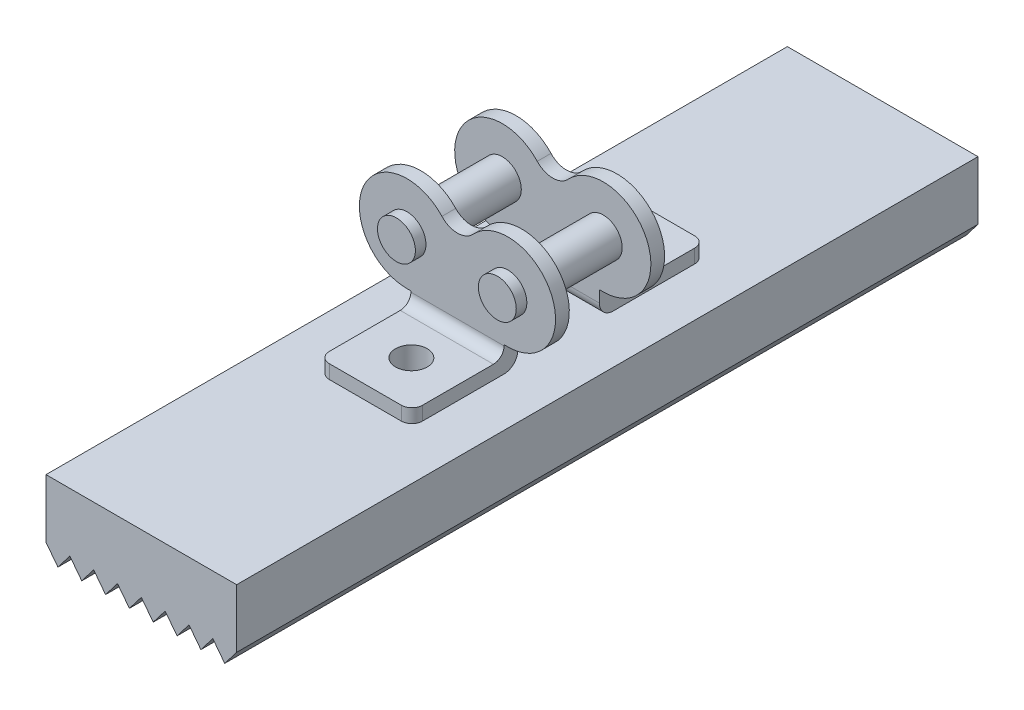
from build123d import *
from build123d.topology import SkipClean

# Parameters (mm, degrees)
BOSS_EXTRUDE1_DEPTH      = 1.3
BOSS_EXTRUDE2_DEPTH      = 10
BOSS_EXTRUDE2_DEPTH_BACK = 2.3
SKETCH2_R                = 1.79
SKETCH4_W                = 8.8
SKETCH4_H                = 1.3
BOSS_EXTRUDE4_DEPTH      = 2.4
SKETCH3_W                = 8.8
SKETCH3_H                = 10
BOSS_EXTRUDE3_DEPTH      = 1.3
FILLET4_R                = 1.3
FILLET6_R                = 1
SKETCH5_R                = 1.5
CUT_EXTRUDE1_DEPTH       = 2.4
FILLET7_R                = 1
FILLET4_OF_MIRROR1_R     = 1.3
FILLET6_OF_MIRROR1_R     = 1
FILLET7_OF_MIRROR1_R     = 1
BOSS_EXTRUDE5_START      = 7
SKETCH6_W                = 18
SKETCH6_H                = 70
SKETCH6_R                = 1.5
BOSS_EXTRUDE5_DEPTH      = 7
SKETCH9_R                = 4
CUT_EXTRUDE3_DEPTH       = 3
CUT_EXTRUDE4_DEPTH       = 72.965296541


with BuildPart() as part:
    # Sketch1 → Boss-Extrude1 (new body)
    with BuildSketch(Plane.XY):
        with BuildLine():
            Line((-4.7625, -4.5), (4.7625, -4.5))
            ThreePointArc((4.7625, -4.5), (8.887505516, 1.798424168), (1.465384615, 3.062520227))
            ThreePointArc((1.465384615, 3.062520227), (0, 2.423640328), (-1.465384615, 3.062520227))
            ThreePointArc((-1.465384615, 3.062520227), (-8.887505516, 1.798424168), (-4.7625, -4.5))
        make_face()
    boss_extrude1 = extrude(amount=BOSS_EXTRUDE1_DEPTH)

    # Sketch2 → Boss-Extrude2 (add, two sides: drawn at the far end of the back side and taken through both)
    with BuildSketch(Plane.XY.offset(1.3).offset(-BOSS_EXTRUDE2_DEPTH_BACK)):
        with Locations((-4.7625, 0)):
            Circle(SKETCH2_R)
        with Locations((4.7625, 0)):
            Circle(SKETCH2_R)
    extrude(amount=BOSS_EXTRUDE2_DEPTH + BOSS_EXTRUDE2_DEPTH_BACK)

    # Sketch4 → Boss-Extrude4 (add)
    with BuildSketch(Plane.XZ.offset(4.5)):
        with Locations((0, 0.65)):
            Rectangle(SKETCH4_W, SKETCH4_H)
    boss_extrude4 = extrude(amount=BOSS_EXTRUDE4_DEPTH)

    # Sketch3 → Boss-Extrude3 (add)
    with BuildSketch(Plane.XZ.offset(6.9)):
        with Locations((0, -3.7)):
            Rectangle(SKETCH3_W, SKETCH3_H)
    boss_extrude3 = extrude(amount=-BOSS_EXTRUDE3_DEPTH)

    # Fillet4
    fillet4_edges = [part.edges().sort_by_distance(p)[0] for p in [
        (0, -6.9, 1.3),
    ]]
    fillet(fillet4_edges, radius=FILLET4_R)

    # Fillet6
    fillet6_edges = [part.edges().sort_by_distance(p)[0] for p in [
        (0, -5.6, 0),
    ]]
    fillet(fillet6_edges, radius=FILLET6_R)

    # Sketch5 → Cut-Extrude1 (cut)
    with BuildSketch(Plane.XZ.offset(6.9)):
        with Locations(Location((0, -4.35, 0), (0, 0, 270))):
            Circle(SKETCH5_R)
    cut_extrude1 = extrude(amount=-CUT_EXTRUDE1_DEPTH, mode=Mode.SUBTRACT)

    # Fillet7
    fillet7_edges = [part.edges().sort_by_distance(p)[0] for p in [
        (-4.4, -6.25, -8.7),
        (4.4, -6.25, -8.7),
    ]]
    fillet(fillet7_edges, radius=FILLET7_R)

    # Mirror1: Boss-Extrude1, Boss-Extrude4, Boss-Extrude3, Cut-Extrude1 across plane
    add(boss_extrude1.mirror(Plane(origin=(0, 0, 5.15), x_dir=(1, 0, 0), z_dir=(0, 0, -1))))
    add(boss_extrude4.mirror(Plane(origin=(0, 0, 5.15), x_dir=(1, 0, 0), z_dir=(0, 0, -1))))
    add(boss_extrude3.mirror(Plane(origin=(0, 0, 5.15), x_dir=(1, 0, 0), z_dir=(0, 0, -1))))
    add(cut_extrude1.mirror(Plane(origin=(0, 0, 5.15), x_dir=(1, 0, 0), z_dir=(0, 0, -1))), mode=Mode.SUBTRACT)

    # Fillet4 of Mirror1
    fillet4_of_mirror1_edges = [part.edges().sort_by_distance(p)[0] for p in [
        (0, -6.9, 9),
    ]]
    fillet(fillet4_of_mirror1_edges, radius=FILLET4_OF_MIRROR1_R)

    # Fillet6 of Mirror1
    fillet6_of_mirror1_edges = [part.edges().sort_by_distance(p)[0] for p in [
        (0, -5.6, 10.3),
    ]]
    fillet(fillet6_of_mirror1_edges, radius=FILLET6_OF_MIRROR1_R)

    # Fillet7 of Mirror1
    fillet7_of_mirror1_edges = [part.edges().sort_by_distance(p)[0] for p in [
        (-4.4, -6.25, 19),
        (4.4, -6.25, 19),
    ]]
    fillet(fillet7_of_mirror1_edges, radius=FILLET7_OF_MIRROR1_R)

    # Sketch6 → Boss-Extrude5 (add)
    with SkipClean():  # the faces are left unmerged after this step: merging them gives an invalid solid
        with BuildSketch(Plane.XZ.offset(6.9).offset(BOSS_EXTRUDE5_START)):
            with Locations((0, 5.15)):
                Rectangle(SKETCH6_W, SKETCH6_H)
            with Locations(Location((0, 14.65, 0), (0, 0, 270))):
                Circle(SKETCH6_R, mode=Mode.SUBTRACT)
            with Locations(Location((0, -4.35, 0), (0, 0, 270))):
                Circle(SKETCH6_R, mode=Mode.SUBTRACT)
        extrude(amount=-BOSS_EXTRUDE5_DEPTH)

    # Sketch9 → Cut-Extrude3 (cut)
    with SkipClean():  # the faces are left unmerged after this step: merging them gives an invalid solid
        with BuildSketch(Plane.XZ.offset(13.9)):
            with Locations(Location((0, 14.65, 0), (0, 0, 270))):
                Circle(SKETCH9_R)
            with Locations(Location((0, -4.35, 0), (0, 0, 270))):
                Circle(SKETCH9_R)
        extrude(amount=-CUT_EXTRUDE3_DEPTH, mode=Mode.SUBTRACT)

    # Sketch11 → Cut-Extrude4 (cut, through all)
    with SkipClean():  # the faces are left unmerged after this step: merging them gives an invalid solid
        with BuildSketch(Plane.XY.offset(40.15)):
            Polygon((9, -12.432975638), (7.875, -13.9), (6.75, -12.432975638), (5.625, -13.9), (4.5, -12.432975638), (3.375, -13.9), (2.25, -12.432975638), (1.125, -13.9), (0, -12.432975638), (-1.125, -13.9), (-2.25, -12.432975638), (-3.375, -13.9), (-4.5, -12.432975638), (-5.625, -13.9), (-6.75, -12.432975638), (-7.875, -13.9), (-9, -12.432975638), (-9, -14.9), (9, -14.9), align=None)
        extrude(amount=-CUT_EXTRUDE4_DEPTH, mode=Mode.SUBTRACT)


solid = part.part
